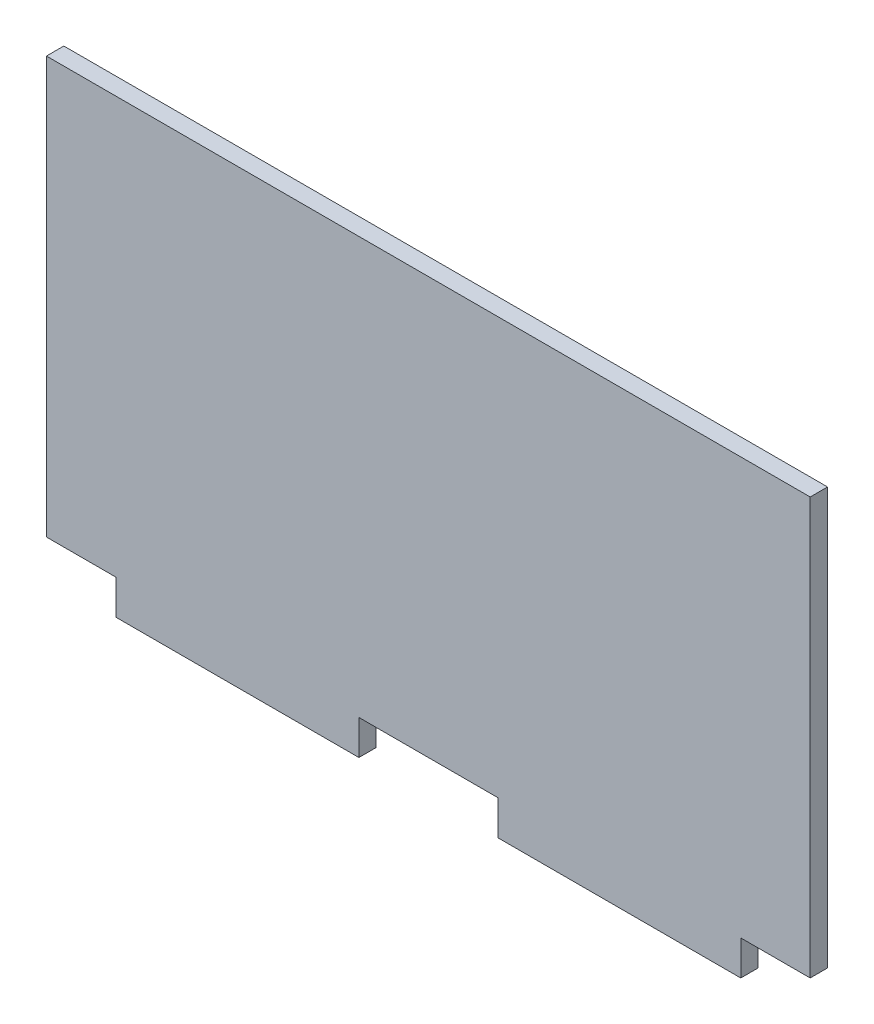
from build123d import *

# Parameters (mm, degrees)
BOSS_EXTRU_1_DEPTH = 5


with BuildPart() as part:
    # Esquisse1 → Boss.-Extru.1 (new body)
    with BuildSketch(Plane.XY):
        Polygon((-75.623987034, 0), (-55.623987034, 0), (-55.623987034, -10), (14.376012966, -10), (14.376012966, 0), (54.376012966, 0), (54.376012966, -10), (124.376012966, -10), (124.376012966, 0), (144.376012966, 0), (144.376012966, 120), (-75.623987034, 120), align=None)
    extrude(amount=BOSS_EXTRU_1_DEPTH)


solid = part.part
